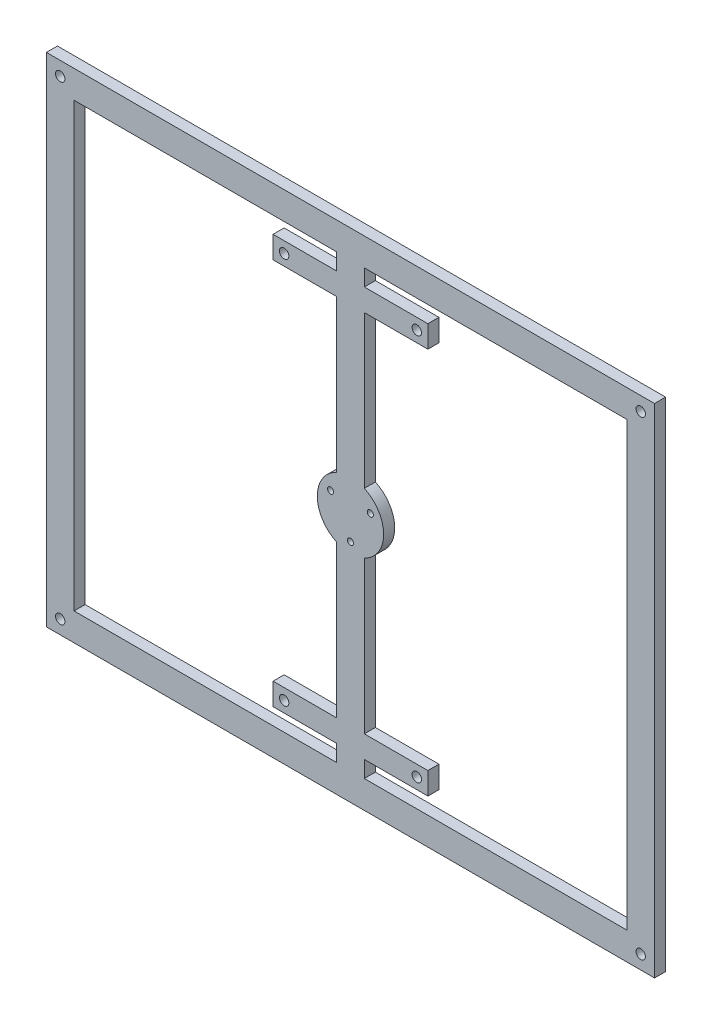
from build123d import *

# Parameters (mm, degrees)
LOWER_PERIMETER_START             = -8
SKETCH1_W                         = 220
SKETCH1_H                         = 180
SKETCH1_W_2                       = 200
SKETCH1_H_2                       = 160
LOWER_PERIMETER_DEPTH             = 4
CENTRE_SPINE_START                = -8
SKETCH2_W                         = 10
SKETCH2_H                         = 170
CENTRE_SPINE_DEPTH                = 4
PEDESTAL_LANDING_START            = -8
SKETCH3_R                         = 12
PEDESTAL_LANDING_DEPTH            = 4
BASE_LANDING_70_START             = -8
SKETCH4_W                         = 56
SKETCH4_H                         = 8
BASE_LANDING_70_DEPTH             = 4
SKETCH5_W                         = 56
SKETCH5_H                         = 8
BASE_LANDING_70_2_DEPTH           = 4
SKETCH6_R                         = 1.7
EIGHT_M3_CLEARANCE_DEPTH          = 4.01
SKETCH7_R                         = 1.1
PEDESTAL_THREE_M2_CLEARANCE_DEPTH = 4.01


with BuildPart() as part:
    # Sketch1 → Lower_Perimeter (new body)
    with BuildSketch(Plane.XY.offset(LOWER_PERIMETER_START)):
        Rectangle(SKETCH1_W, SKETCH1_H)
        Rectangle(SKETCH1_W_2, SKETCH1_H_2, mode=Mode.SUBTRACT)
    extrude(amount=LOWER_PERIMETER_DEPTH)

    # Sketch2 → Centre_Spine (add)
    with BuildSketch(Plane.XY.offset(CENTRE_SPINE_START)):
        Rectangle(SKETCH2_W, SKETCH2_H)
    extrude(amount=CENTRE_SPINE_DEPTH)

    # Sketch3 → Pedestal_Landing (add)
    with BuildSketch(Plane.XY.offset(PEDESTAL_LANDING_START)):
        Circle(SKETCH3_R)
    extrude(amount=PEDESTAL_LANDING_DEPTH)

    # Sketch4 → Base_Landing_-70 (add)
    with BuildSketch(Plane.XY.offset(BASE_LANDING_70_START)):
        with Locations((0, -70)):
            Rectangle(SKETCH4_W, SKETCH4_H)
    extrude(amount=BASE_LANDING_70_DEPTH)

    # Sketch5 → Base_Landing_70 2 (add)
    with BuildSketch(Plane.XY.offset(BASE_LANDING_70_START)):
        with Locations((0, 70)):
            Rectangle(SKETCH5_W, SKETCH5_H)
    extrude(amount=BASE_LANDING_70_2_DEPTH)

    # Sketch6 → Eight_M3_Clearance (cut)
    with BuildSketch(Plane.XY.offset(-4)):
        with Locations((-105, -85)):
            Circle(SKETCH6_R)
        with Locations((-105, 85)):
            Circle(SKETCH6_R)
        with Locations((105, -85)):
            Circle(SKETCH6_R)
        with Locations((105, 85)):
            Circle(SKETCH6_R)
        with Locations((-24, -70)):
            Circle(SKETCH6_R)
        with Locations((-24, 70)):
            Circle(SKETCH6_R)
        with Locations((24, -70)):
            Circle(SKETCH6_R)
        with Locations((24, 70)):
            Circle(SKETCH6_R)
    extrude(amount=-EIGHT_M3_CLEARANCE_DEPTH, mode=Mode.SUBTRACT)

    # Sketch7 → Pedestal_Three_M2_Clearance (cut)
    with BuildSketch(Plane.XY.offset(-4)):
        with Locations((7.188010851, 4.15)):
            Circle(SKETCH7_R)
        with Locations((-7.188010851, 4.15)):
            Circle(SKETCH7_R)
        with Locations((0, -8.3)):
            Circle(SKETCH7_R)
    extrude(amount=-PEDESTAL_THREE_M2_CLEARANCE_DEPTH, mode=Mode.SUBTRACT)


solid = part.part
